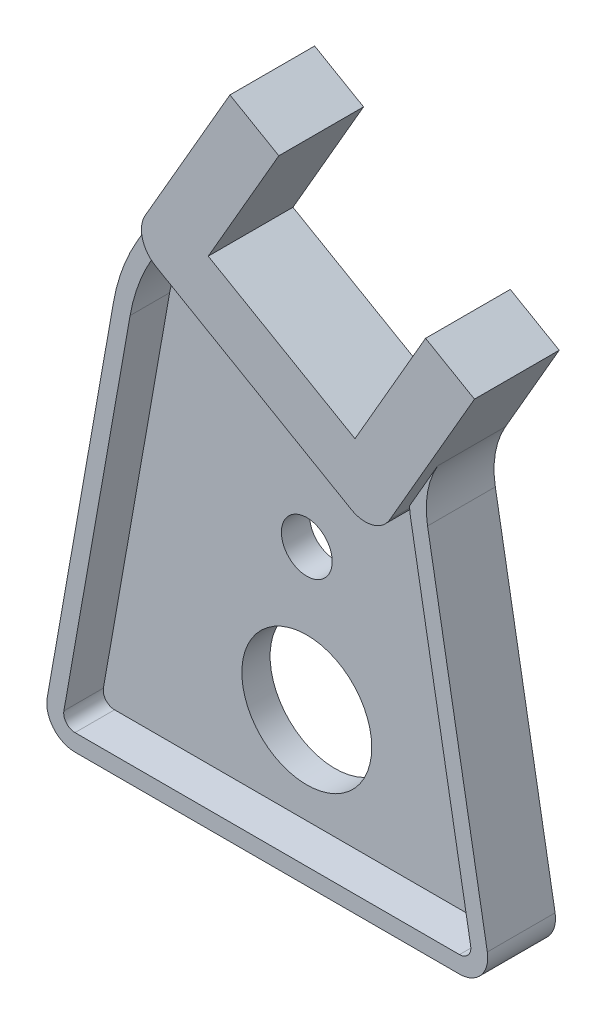
from build123d import *

# Parameters (mm, degrees)
SKETCH1_R           = 11.5
SKETCH1_R_2         = 4.5
BOSS_EXTRUDE1_DEPTH = 5
BOSS_EXTRUDE2_DEPTH = 12
BOSS_EXTRUDE3_DEPTH = 15


with BuildPart() as part:
    # Sketch1 → Boss-Extrude1 (new body)
    with BuildSketch(Plane.XY):
        with BuildLine():
            ThreePointArc((-38.965270802, 5.868240888), (-37.871454253, 1.786061952), (-34.041232037, 0))
            Line((-34.041232037, 0), (34.041232037, 0))
            ThreePointArc((34.041232037, 0), (37.871454253, 1.786061952), (38.965270802, 5.868240888))
            Line((38.965270802, 5.868240888), (28.380934182, 65.894996734))
            ThreePointArc((28.380934182, 65.894996734), (28.380934182, 71.104442064), (30.162669421, 75.999719399))
            Line((30.162669421, 75.999719399), (39.689110868, 92.5))
            Line((39.689110868, 92.5), (31.02885683, 97.5))
            Line((31.02885683, 97.5), (18.52885683, 75.849364905))
            Line((18.52885683, 75.849364905), (-7.451905284, 90.849364905))
            Line((-7.451905284, 90.849364905), (5.048094716, 112.5))
            Line((5.048094716, 112.5), (-3.612159322, 117.5))
            Line((-3.612159322, 117.5), (-23.085586146, 83.771035343))
            ThreePointArc((-23.085586146, 83.771035343), (-25.663938741, 78.241740359), (-27.242968369, 72.348721561))
            Line((-27.242968369, 72.348721561), (-38.965270802, 5.868240888))
        make_face()
        with Locations((0, 20)):
            Circle(SKETCH1_R, mode=Mode.SUBTRACT)
        with Locations((0, 45)):
            Circle(SKETCH1_R_2, mode=Mode.SUBTRACT)
    extrude(amount=BOSS_EXTRUDE1_DEPTH)

    # Sketch1<3> → Boss-Extrude2 (add)
    with BuildSketch(Plane.XY):
        with BuildLine():
            ThreePointArc((-38.965270802, 5.868240888), (-37.871454253, 1.786061952), (-34.041232037, 0))
            Line((-34.041232037, 0), (34.041232037, 0))
            ThreePointArc((34.041232037, 0), (37.871454253, 1.786061952), (38.965270802, 5.868240888))
            Line((38.965270802, 5.868240888), (28.380934182, 65.894996734))
            ThreePointArc((28.380934182, 65.894996734), (28.380934182, 71.104442064), (30.162669421, 75.999719399))
            Line((30.162669421, 75.999719399), (25.187732235, 67.382875429))
            ThreePointArc((25.187732235, 67.382875429), (25.278878582, 66.375106712), (25.426510923, 65.374052201))
            Line((25.426510923, 65.374052201), (36.010847543, 5.347296355))
            ThreePointArc((36.010847543, 5.347296355), (35.573320923, 3.714424781), (34.041232037, 3))
            Line((34.041232037, 3), (-34.041232037, 3))
            ThreePointArc((-34.041232037, 3), (-35.573320923, 3.714424781), (-36.010847543, 5.347296355))
            Line((-36.010847543, 5.347296355), (-24.28854511, 71.827777028))
            ThreePointArc((-24.28854511, 71.827777028), (-22.844860879, 77.215679929), (-20.487509935, 82.271035343))
            Line((-20.487509935, 82.271035343), (-18.305370958, 86.05061092))
            ThreePointArc((-18.305370958, 86.05061092), (-19.274182883, 88.739179708), (-18.612159322, 91.519237886))
            Line((-18.612159322, 91.519237886), (-23.085586146, 83.771035343))
            ThreePointArc((-23.085586146, 83.771035343), (-25.663938741, 78.241740359), (-27.242968369, 72.348721561))
            Line((-27.242968369, 72.348721561), (-38.965270802, 5.868240888))
        make_face()
    extrude(amount=BOSS_EXTRUDE2_DEPTH)

    # Sketch1<4> → Boss-Extrude3 (add)
    with BuildSketch(Plane.XY):
        with BuildLine():
            Line((25.187732235, 67.382875429), (30.162669421, 75.999719399))
            Line((30.162669421, 75.999719399), (39.689110868, 92.5))
            Line((39.689110868, 92.5), (31.02885683, 97.5))
            Line((31.02885683, 97.5), (18.52885683, 75.849364905))
            Line((18.52885683, 75.849364905), (-7.451905284, 90.849364905))
            Line((-7.451905284, 90.849364905), (5.048094716, 112.5))
            Line((5.048094716, 112.5), (-3.612159322, 117.5))
            Line((-3.612159322, 117.5), (-18.612159322, 91.519237886))
            ThreePointArc((-18.612159322, 91.519237886), (-19.274182883, 88.739179708), (-18.305370958, 86.05061092))
            ThreePointArc((-18.305370958, 86.05061092), (-17.613984793, 85.291223321), (-16.782032303, 84.689110868))
            Line((-16.782032303, 84.689110868), (17.858983849, 64.689110868))
            ThreePointArc((17.858983849, 64.689110868), (21.653079074, 64.189608755), (24.689110868, 66.519237886))
            Line((24.689110868, 66.519237886), (25.187732235, 67.382875429))
        make_face()
    extrude(amount=BOSS_EXTRUDE3_DEPTH)


solid = part.part
